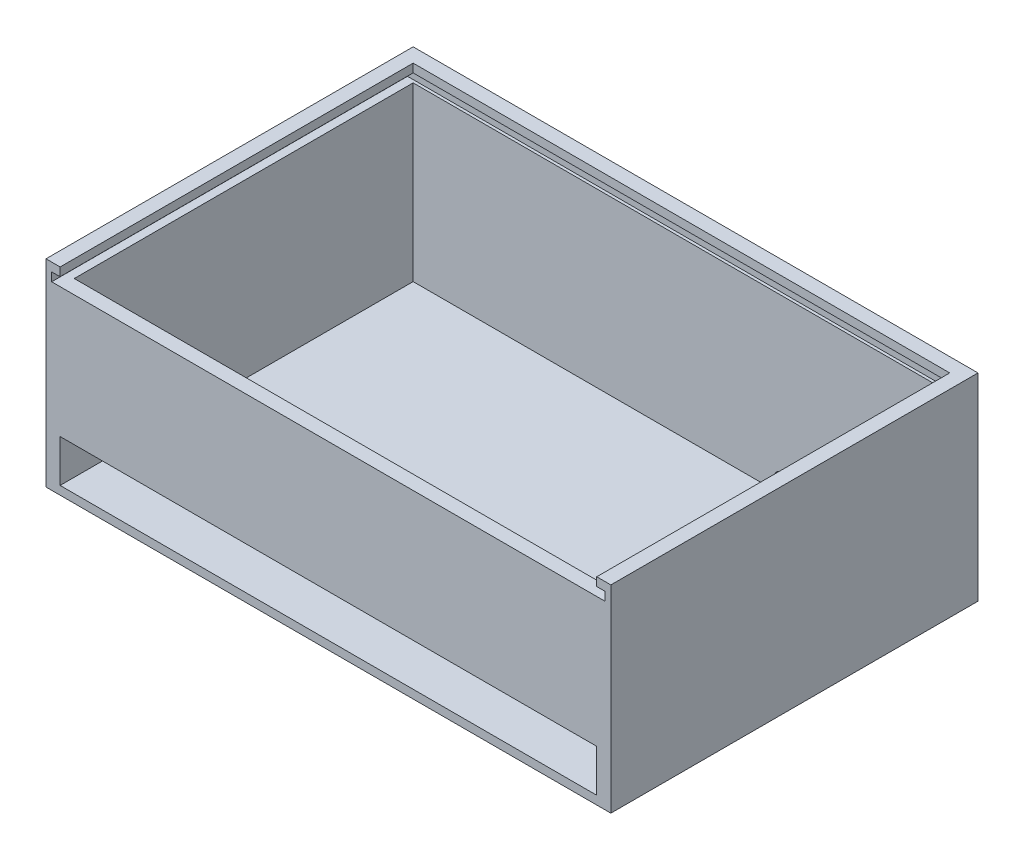
from build123d import *

# Parameters (mm, degrees)
CROQUIS1_W              = 200
CROQUIS1_H              = 130
SALIENTE_EXTRUIR1_DEPTH = 3
CROQUIS2_W              = 5
CROQUIS2_H              = 5
CROQUIS2_H_2            = 120
CROQUIS2_W_2            = 190
SALIENTE_EXTRUIR2_DEPTH = 67
CROQUIS3_W              = 190
CROQUIS3_H              = 15
CORTAR_EXTRUIR1_DEPTH   = 5
CROQUIS4_W              = 196
CROQUIS4_H              = 3.05
CORTAR_EXTRUIR2_DEPTH   = 126
CROQUIS7_W              = 190
CROQUIS7_H              = 3
CORTAR_EXTRUIR3_DEPTH   = 5
CROQUIS8_R              = 2
CORTAR_EXTRUIR4_DEPTH   = 5


with BuildPart() as part:
    # Croquis1 → Saliente-Extruir1 (new body)
    with BuildSketch(Plane(origin=(0, 0, 0), x_dir=(1, 0, 0), z_dir=(0, 1, 0))):
        Rectangle(CROQUIS1_W, CROQUIS1_H)
    extrude(amount=SALIENTE_EXTRUIR1_DEPTH)

    # Croquis2 → Saliente-Extruir2 (add)
    with BuildSketch(Plane(origin=(0, 3, 0), x_dir=(1, 0, 0), z_dir=(0, 1, 0))):
        with Locations((-97.5, 62.5)):
            Rectangle(CROQUIS2_W, CROQUIS2_H)
        with Locations((-97.5, 0)):
            Rectangle(CROQUIS2_W, CROQUIS2_H_2)
        with Locations((0, 62.5)):
            Rectangle(CROQUIS2_W_2, CROQUIS2_H)
        with Locations((97.5, 62.5)):
            Rectangle(CROQUIS2_W, CROQUIS2_H)
        with Locations((-97.5, -62.5)):
            Rectangle(CROQUIS2_W, CROQUIS2_H)
        with Locations((97.5, 0)):
            Rectangle(CROQUIS2_W, CROQUIS2_H_2)
        with Locations((0, -62.5)):
            Rectangle(CROQUIS2_W_2, CROQUIS2_H)
        with Locations((97.5, -62.5)):
            Rectangle(CROQUIS2_W, CROQUIS2_H)
    extrude(amount=SALIENTE_EXTRUIR2_DEPTH)

    # Croquis3 → Cortar-Extruir1 (cut)
    with BuildSketch(Plane.XY.offset(65)):
        with Locations((0, 10.5)):
            Rectangle(CROQUIS3_W, CROQUIS3_H)
    extrude(amount=-CORTAR_EXTRUIR1_DEPTH, mode=Mode.SUBTRACT)

    # Croquis4 → Cortar-Extruir2 (cut)
    with BuildSketch(Plane.XY.offset(65)):
        with Locations((0, 65.475)):
            Rectangle(CROQUIS4_W, CROQUIS4_H)
    extrude(amount=-CORTAR_EXTRUIR2_DEPTH, mode=Mode.SUBTRACT)

    # Croquis7 → Cortar-Extruir3 (cut)
    with BuildSketch(Plane(origin=(0, 0, 60), x_dir=(-1, 0, 0), z_dir=(0, 0, -1))):
        with Locations((0, 68.5)):
            Rectangle(CROQUIS7_W, CROQUIS7_H)
    extrude(amount=-CORTAR_EXTRUIR3_DEPTH, mode=Mode.SUBTRACT)

    # Croquis8 → Cortar-Extruir4 (cut)
    with BuildSketch(Plane(origin=(0, 0, -65), x_dir=(-1, 0, 0), z_dir=(0, 0, -1))):
        with Locations((-35, 7.5)):
            Circle(CROQUIS8_R)
    extrude(amount=-CORTAR_EXTRUIR4_DEPTH, mode=Mode.SUBTRACT)


solid = part.part
